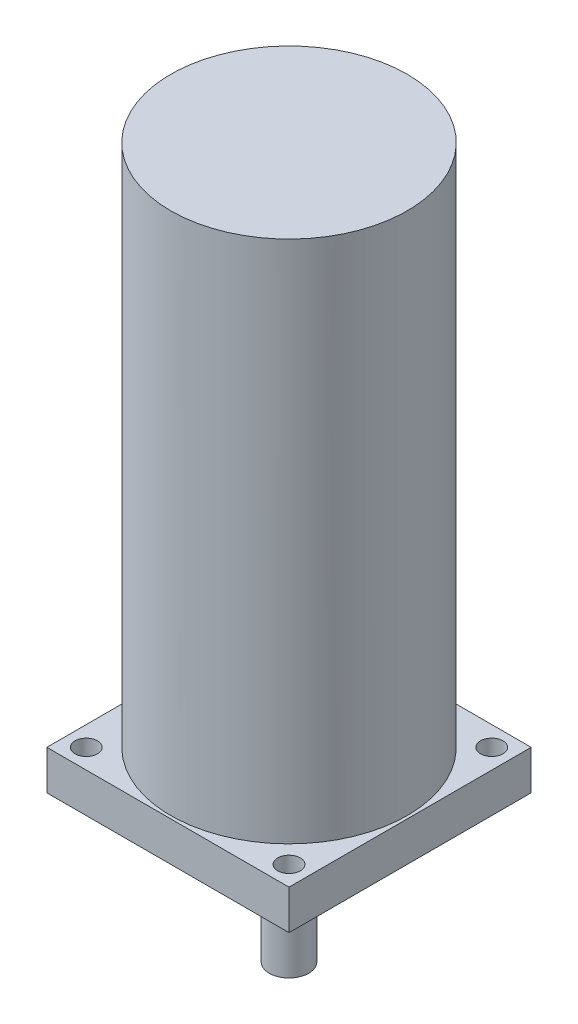
from build123d import *

# Parameters (mm, degrees)
SKETCH1_R               = 21
BOSS_EXTRUDE1_DEPTH     = 100
SKETCH3_R               = 3.5
BOSS_EXTRUDE3_DEPTH     = 26
SKETCH4_R               = 7
BOSS_EXTRUDE4_DEPTH     = 7
SKETCH5_W               = 43
SKETCH5_H               = 43
BOSS_EXTRUDE5_DEPTH     = 7
CUT_EXTRUDE1_DEPTH      = 105.52033295
CUT_EXTRUDE1_DEPTH_BACK = 105.52033295


with BuildPart() as part:
    # Sketch1 → Boss-Extrude1 (new body)
    with BuildSketch(Plane(origin=(0, 0, 0), x_dir=(1, 0, 0), z_dir=(0, 1, 0))):
        with Locations(Location((0, 0, 0), (0, 0, 270))):
            Circle(SKETCH1_R)
    extrude(amount=BOSS_EXTRUDE1_DEPTH)

    # Sketch3 → Boss-Extrude3 (add)
    with BuildSketch(Plane.XZ):
        with Locations(Location((0, 0, 0), (0, 0, 90))):
            Circle(SKETCH3_R)
    extrude(amount=BOSS_EXTRUDE3_DEPTH)

    # Sketch4 → Boss-Extrude4 (add)
    with BuildSketch(Plane.XZ):
        with Locations(Location((0, 0, 0), (0, 0, 90))):
            Circle(SKETCH4_R)
    extrude(amount=BOSS_EXTRUDE4_DEPTH)

    # Sketch5 → Boss-Extrude5 (add)
    with BuildSketch(Plane.XZ):
        Rectangle(SKETCH5_W, SKETCH5_H)
    extrude(amount=-BOSS_EXTRUDE5_DEPTH)

    # Sketch6 → Cut-Extrude1 (cut, two sides: drawn at the far end of the back side and taken through both)
    with BuildSketch(Plane.XZ.offset(-CUT_EXTRUDE1_DEPTH_BACK)):
        with BuildLine():
            ThreePointArc((-16, 18), (-19.414213562, 19.414213562), (-18, 16))
            Line((-18, 16), (-18, 18))
            Line((-18, 18), (-16, 18))
        make_face()
        with BuildLine():
            Line((-18, 18), (-18, 16))
            ThreePointArc((-18, 16), (-16.585786438, 16.585786438), (-16, 18))
            Line((-16, 18), (-18, 18))
        make_face()
        with BuildLine():
            Line((-18, -16), (-18, -18))
            Line((-18, -18), (-16, -18))
            ThreePointArc((-16, -18), (-16.585786438, -16.585786438), (-18, -16))
        make_face()
        with BuildLine():
            Line((-16, -18), (-18, -18))
            Line((-18, -18), (-18, -16))
            ThreePointArc((-18, -16), (-19.414213562, -19.414213562), (-16, -18))
        make_face()
        with BuildLine():
            ThreePointArc((18, -16), (16.585786438, -16.585786438), (16, -18))
            Line((16, -18), (18, -18))
            Line((18, -18), (18, -16))
        make_face()
        with BuildLine():
            Line((18, -18), (16, -18))
            ThreePointArc((16, -18), (18, -20), (20, -18))
            ThreePointArc((20, -18), (19.414213562, -16.585786438), (18, -16))
            Line((18, -16), (18, -18))
        make_face()
        with BuildLine():
            ThreePointArc((16, 18), (16.585786438, 16.585786438), (18, 16))
            Line((18, 16), (18, 18))
            Line((18, 18), (16, 18))
        make_face()
        with BuildLine():
            Line((18, 18), (18, 16))
            ThreePointArc((18, 16), (19.414213562, 16.585786438), (20, 18))
            ThreePointArc((20, 18), (18, 20), (16, 18))
            Line((16, 18), (18, 18))
        make_face()
    extrude(amount=CUT_EXTRUDE1_DEPTH + CUT_EXTRUDE1_DEPTH_BACK, mode=Mode.SUBTRACT)


solid = part.part
